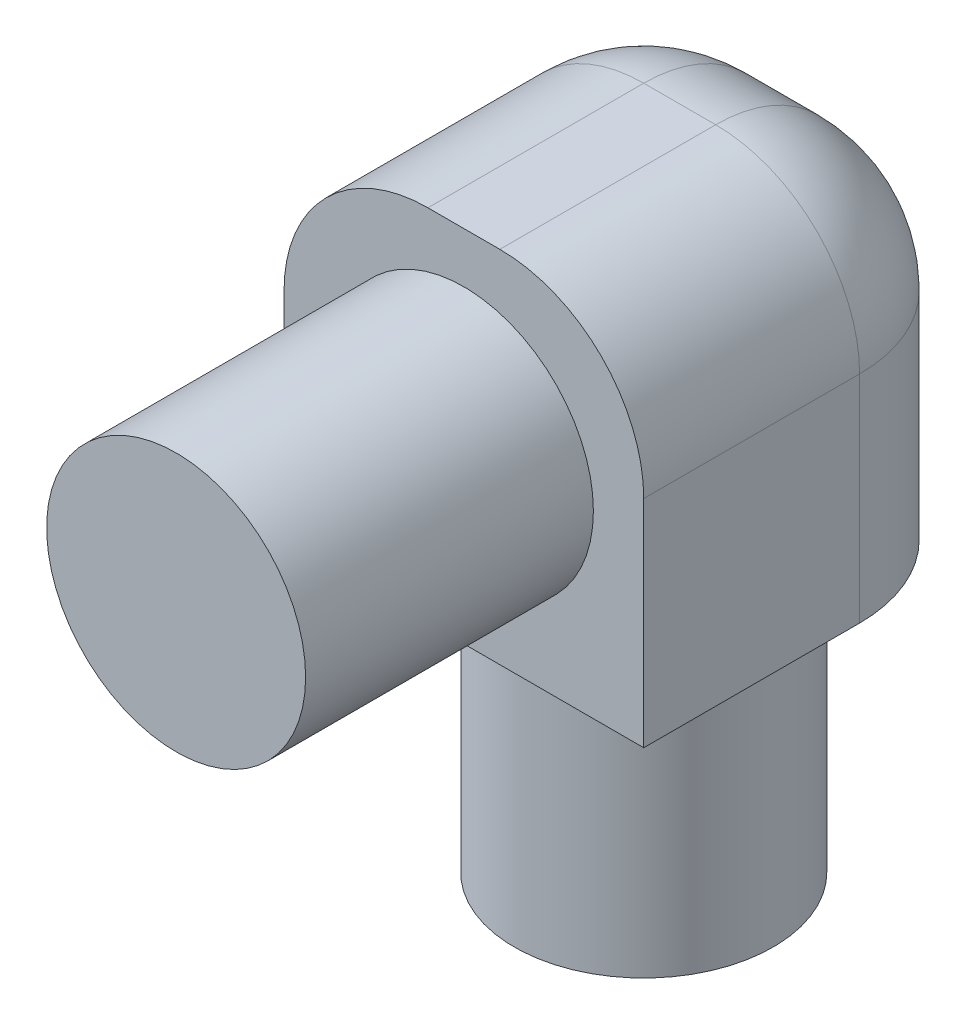
from build123d import *

# Parameters (mm, degrees)
SKETCH1_W           = 50
SKETCH1_H           = 50
BOSS_EXTRUDE1_DEPTH = 50
SKETCH3_R           = 18
BOSS_EXTRUDE2_DEPTH = 40
SKETCH4_R           = 18
BOSS_EXTRUDE3_DEPTH = 40
FILLET1_R           = 20


with BuildPart() as part:
    # Sketch1 → Boss-Extrude1 (new body)
    with BuildSketch(Plane(origin=(0, 0, 0), x_dir=(1, 0, 0), z_dir=(0, 1, 0))):
        Rectangle(SKETCH1_W, SKETCH1_H)
    extrude(amount=BOSS_EXTRUDE1_DEPTH)

    # Sketch3 → Boss-Extrude2 (add)
    with BuildSketch(Plane.XY.offset(25)):
        with Locations((0, 25)):
            Circle(SKETCH3_R)
    extrude(amount=BOSS_EXTRUDE2_DEPTH)

    # Sketch4 → Boss-Extrude3 (add)
    with BuildSketch(Plane.XZ):
        with Locations(Location((0, 0, 0), (0, 0, 270))):
            Circle(SKETCH4_R)
    extrude(amount=BOSS_EXTRUDE3_DEPTH)

    # Fillet1
    fillet1_edges = [part.edges().sort_by_distance(p)[0] for p in [
        (25, 50, 0),
        (0, 50, -25),
        (-25, 50, 0),
        (-25, 25, -25),
        (25, 25, -25),
    ]]
    fillet(fillet1_edges, radius=FILLET1_R)


solid = part.part
